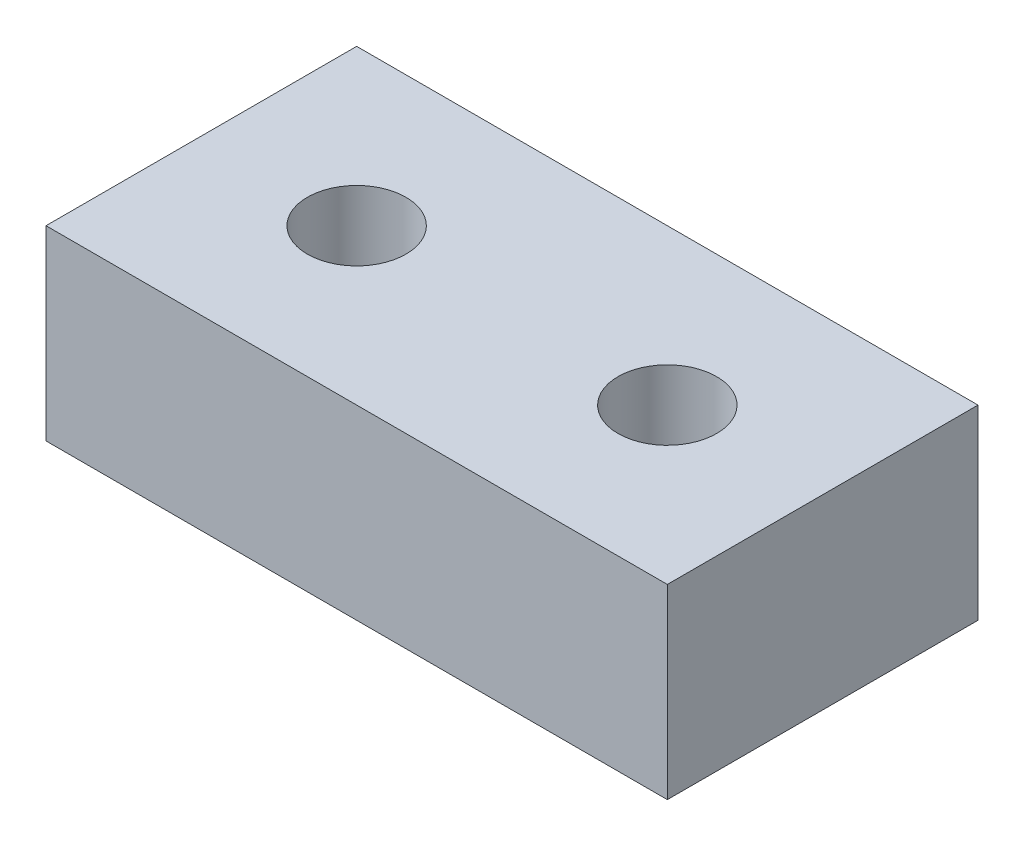
from build123d import *

# Parameters (mm, degrees)
SKETCH1_W           = 10
SKETCH1_H           = 10
SKETCH1_R           = 1.5875
BOSS_EXTRUDE1_DEPTH = 6


with BuildPart() as part:
    # Sketch1 → Boss-Extrude1 (new body)
    # profile 1 of 4: a face of its own
    with BuildSketch(Plane(origin=(0, 0, 0), x_dir=(1, 0, 0), z_dir=(0, 1, 0))):
        with BuildLine():
            Line((0, -5), (0, 5))
            Line((0, 5), (-5, 2.5))
            Line((-5, 2.5), (-5, 1.5875))
            ThreePointArc((-5, 1.5875), (-3.877467985, 1.122532015), (-3.4125, 0))
            ThreePointArc((-3.4125, 0), (-3.877467985, -1.122532015), (-5, -1.5875))
            Line((-5, -1.5875), (-5, -5))
            Line((-5, -5), (0, -5))
        make_face()
    # profile 2 of 4: a face of its own
    with BuildSketch(Plane(origin=(0, 0, 0), x_dir=(1, 0, 0), z_dir=(0, 1, 0))):
        with BuildLine():
            Line((-5, 2.5), (-10, 0))
            Line((-10, 0), (-10, -5))
            Line((-10, -5), (-5, -5))
            Line((-5, -5), (-5, -1.5875))
            ThreePointArc((-5, -1.5875), (-6.5875, 0), (-5, 1.5875))
            Line((-5, 1.5875), (-5, 2.5))
        make_face()
    # profile 3 of 4: a face of its own
    with BuildSketch(Plane(origin=(0, 0, 0), x_dir=(1, 0, 0), z_dir=(0, 1, 0))):
        Polygon((0, 5), (-10, 5), (-10, 0), (-5, 2.5), align=None)
    # profile 4 of 4: a face of its own
    with BuildSketch(Plane(origin=(0, 0, 0), x_dir=(1, 0, 0), z_dir=(0, 1, 0))):
        with Locations((5, 0)):
            Rectangle(SKETCH1_W, SKETCH1_H)
        with Locations(Location((5, 0, 0), (0, 0, 270))):
            Circle(SKETCH1_R, mode=Mode.SUBTRACT)
    extrude(amount=BOSS_EXTRUDE1_DEPTH)


solid = part.part
